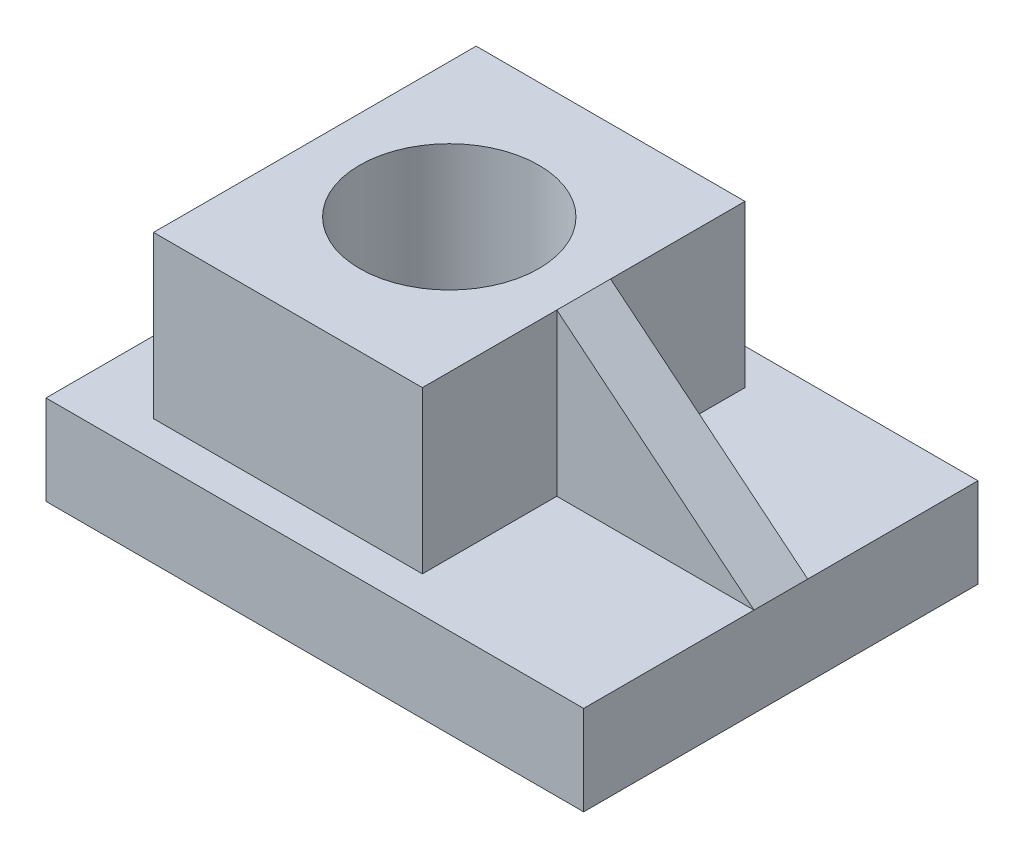
from build123d import *

# Parameters (mm, degrees)
SKETCH_1_W          = 60
SKETCH_1_H          = 44
EXTRUDE_1_DEPTH     = 10
SKETCH_2_W          = 30
SKETCH_2_H          = 36
EXTRUDE_2_DEPTH     = 18
SKETCH_3_R          = 10
CUT_EXTRUDE_1_DEPTH = 47.561786907
RIB_1_REACH         = 48.562
SKETCH_5_WALL_W     = 123.548914622
SKETCH_5_WALL_H     = 6


with BuildPart() as part:
    # 草图1 → 凸台-拉伸1 (new body)
    with BuildSketch(Plane(origin=(0, 0, 0), x_dir=(1, 0, 0), z_dir=(0, 1, 0))):
        Rectangle(SKETCH_1_W, SKETCH_1_H)
    extrude(amount=EXTRUDE_1_DEPTH)

    # 草图2 → 凸台-拉伸2 (add)
    with BuildSketch(Plane(origin=(0, 10, 0), x_dir=(1, 0, 0), z_dir=(0, 1, 0))):
        with Locations((-7, 0)):
            Rectangle(SKETCH_2_W, SKETCH_2_H)
    extrude(amount=EXTRUDE_2_DEPTH)

    # 草图3 → 切除-拉伸1 (cut, through all)
    with BuildSketch(Plane(origin=(0, 28, 0), x_dir=(1, 0, 0), z_dir=(0, 1, 0))):
        with Locations(Location((-7, 0, 0), (0, 0, 270))):
            Circle(SKETCH_3_R)
    extrude(amount=-CUT_EXTRUDE_1_DEPTH, mode=Mode.SUBTRACT)

    # 草图5 wall → 筋1 (add, up to next)
    with BuildSketch(Plane(origin=(19, 19, 0), x_dir=(0.773957299203, -0.633237790257, 0), z_dir=(0.633237790257, 0.773957299203, 0)), mode=Mode.PRIVATE) as rib_1_sk1:
        Rectangle(SKETCH_5_WALL_W, SKETCH_5_WALL_H)
    rib_1_tool1 = extrude(rib_1_sk1.sketch, amount=-RIB_1_REACH, mode=Mode.PRIVATE) - part.part
    add(rib_1_tool1.solids().sort_by_distance((19, 19, 0))[0])


solid = part.part
